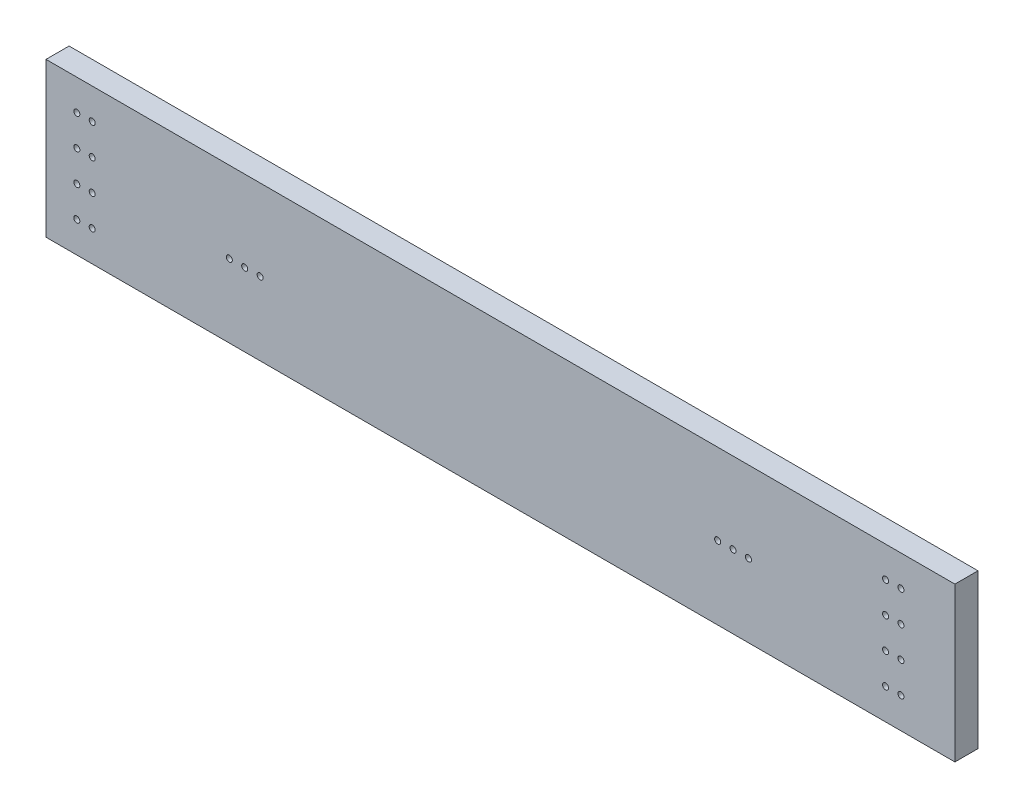
from build123d import *

# Parameters (mm, degrees)
SKETCH1_W           = 749.3
SKETCH1_H           = 127
SKETCH1_R           = 2.4892
BOSS_EXTRUDE1_DEPTH = 9.525


with BuildPart() as part:
    # Sketch1 → Boss-Extrude1 (new, symmetric)
    with BuildSketch(Plane.XY):
        with Locations((374.65, 63.5)):
            Rectangle(SKETCH1_W, SKETCH1_H)
        with Locations(Location((553.72, 60.325, 0), (0, 0, 180))):
            Circle(SKETCH1_R, mode=Mode.SUBTRACT)
        with Locations(Location((176.53, 60.325, 0), (0, 0, 180))):
            Circle(SKETCH1_R, mode=Mode.SUBTRACT)
        with Locations(Location((163.83, 60.325, 0), (0, 0, 180))):
            Circle(SKETCH1_R, mode=Mode.SUBTRACT)
        with Locations(Location((566.42, 60.325, 0), (0, 0, 180))):
            Circle(SKETCH1_R, mode=Mode.SUBTRACT)
        with Locations(Location((579.12, 60.325, 0), (0, 0, 180))):
            Circle(SKETCH1_R, mode=Mode.SUBTRACT)
        with Locations(Location((151.13, 60.325, 0), (0, 0, 180))):
            Circle(SKETCH1_R, mode=Mode.SUBTRACT)
        with Locations(Location((25.4, 25.4, 0), (0, 0, 180))):
            Circle(SKETCH1_R, mode=Mode.SUBTRACT)
        with Locations(Location((38.1, 25.4, 0), (0, 0, 180))):
            Circle(SKETCH1_R, mode=Mode.SUBTRACT)
        with Locations(Location((38.1, 50.8, 0), (0, 0, 180))):
            Circle(SKETCH1_R, mode=Mode.SUBTRACT)
        with Locations(Location((38.1, 76.2, 0), (0, 0, 180))):
            Circle(SKETCH1_R, mode=Mode.SUBTRACT)
        with Locations(Location((38.1, 101.6, 0), (0, 0, 180))):
            Circle(SKETCH1_R, mode=Mode.SUBTRACT)
        with Locations(Location((25.4, 50.8, 0), (0, 0, 180))):
            Circle(SKETCH1_R, mode=Mode.SUBTRACT)
        with Locations(Location((25.4, 76.2, 0), (0, 0, 180))):
            Circle(SKETCH1_R, mode=Mode.SUBTRACT)
        with Locations(Location((25.4, 101.6, 0), (0, 0, 180))):
            Circle(SKETCH1_R, mode=Mode.SUBTRACT)
        with Locations(Location((692.15, 25.4, 0), (0, 0, 180))):
            Circle(SKETCH1_R, mode=Mode.SUBTRACT)
        with Locations(Location((704.85, 25.4, 0), (0, 0, 180))):
            Circle(SKETCH1_R, mode=Mode.SUBTRACT)
        with Locations(Location((704.85, 50.8, 0), (0, 0, 180))):
            Circle(SKETCH1_R, mode=Mode.SUBTRACT)
        with Locations(Location((704.85, 76.2, 0), (0, 0, 180))):
            Circle(SKETCH1_R, mode=Mode.SUBTRACT)
        with Locations(Location((704.85, 101.6, 0), (0, 0, 180))):
            Circle(SKETCH1_R, mode=Mode.SUBTRACT)
        with Locations(Location((692.15, 50.8, 0), (0, 0, 180))):
            Circle(SKETCH1_R, mode=Mode.SUBTRACT)
        with Locations(Location((692.15, 76.2, 0), (0, 0, 180))):
            Circle(SKETCH1_R, mode=Mode.SUBTRACT)
        with Locations(Location((692.15, 101.6, 0), (0, 0, 180))):
            Circle(SKETCH1_R, mode=Mode.SUBTRACT)
    extrude(amount=BOSS_EXTRUDE1_DEPTH, both=True)


solid = part.part
